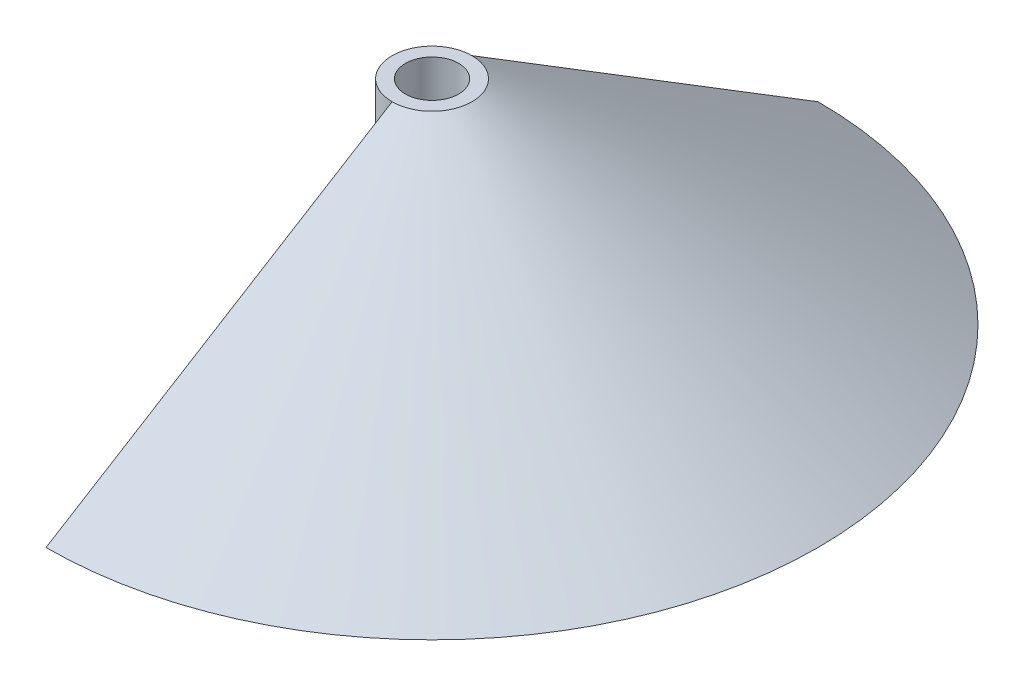
from build123d import *

# Parameters (mm, degrees)
CORTAR_EXTRUIR1_DEPTH = 45.022721406
CROQUIS4_R            = 2
CORTAR_EXTRUIR2_DEPTH = 45.022721406


with BuildPart() as part:
    # Croquis2 → Revolución1 (revolve)
    with BuildSketch(Plane(origin=(0, 0, 0), x_dir=(0, 0, -1), z_dir=(1, 0, 0))):
        Polygon((0, -8), (0, 8), (3, 8), (29, -8), align=None)
    revolve(axis=Axis((0, -8, 0), (0, 1, 0)))

    # Croquis3 → Cortar-Extruir1 (cut, through all)
    with BuildSketch(Plane(origin=(0, 8, 0), x_dir=(1, 0, 0), z_dir=(0, 1, 0))):
        with BuildLine():
            Line((0, 3), (0, 40.325375613))
            Line((0, 40.325375613), (-47.550667512, 40.325375613))
            Line((-47.550667512, 40.325375613), (-47.550667512, -39.963713052))
            Line((-47.550667512, -39.963713052), (0, -39.963713052))
            Line((0, -39.963713052), (0, -3))
            ThreePointArc((0, -3), (-3, 0), (0, 3))
        make_face()
    extrude(amount=-CORTAR_EXTRUIR1_DEPTH, mode=Mode.SUBTRACT)

    # Croquis4 → Cortar-Extruir2 (cut, through all)
    with BuildSketch(Plane(origin=(0, 8, 0), x_dir=(1, 0, 0), z_dir=(0, 1, 0))):
        with Locations(Location((0, 0, 0), (0, 0, 270))):
            Circle(CROQUIS4_R)
    extrude(amount=-CORTAR_EXTRUIR2_DEPTH, mode=Mode.SUBTRACT)


solid = part.part
